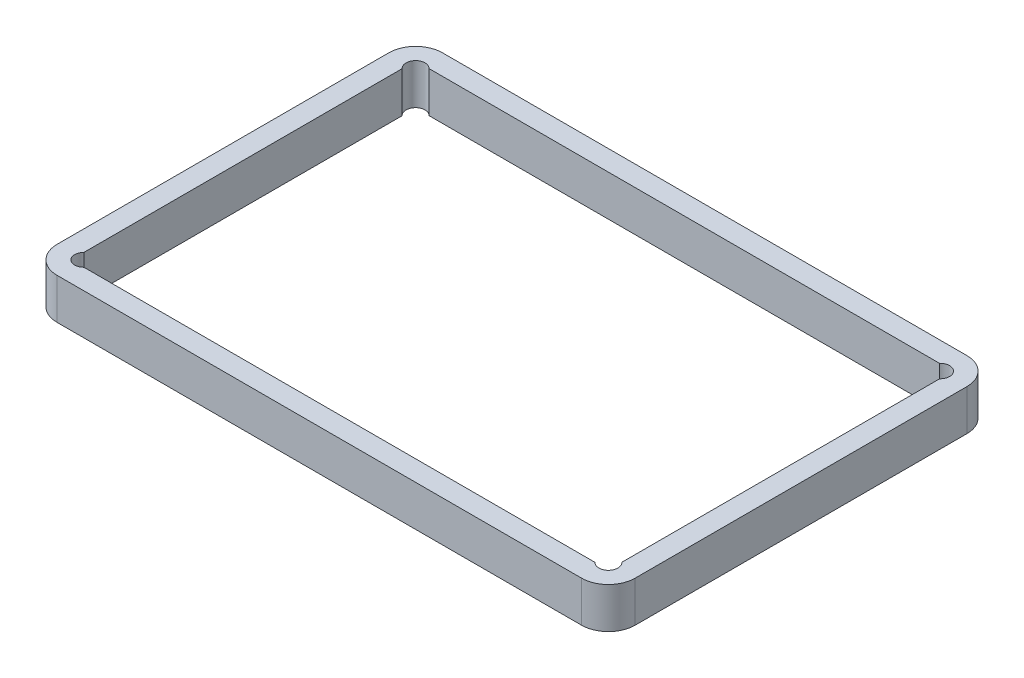
from build123d import *

# Parameters (mm, degrees)
BOSS_EXTRUDE3_DEPTH = 6.35
SKETCH5_R           = 1.4224
SKETCH5_R_2         = 1.4732
CUT_EXTRUDE2_DEPTH  = 55.454774814


with BuildPart() as part:
    # Sketch2 → Boss-Extrude3 (new body)
    with BuildSketch(Plane(origin=(0, 0, 0), x_dir=(1, 0, 0), z_dir=(0, 1, 0))):
        with BuildLine():
            Line((-45, 25.825), (-45, -25.825))
            ThreePointArc((-45, -25.825), (-43.777170811, -28.777170811), (-40.825, -30))
            Line((-40.825, -30), (40.825, -30))
            ThreePointArc((40.825, -30), (43.777170811, -28.777170811), (45, -25.825))
            Line((45, -25.825), (45, 25.825))
            ThreePointArc((45, 25.825), (43.777170811, 28.777170811), (40.825, 30))
            Line((40.825, 30), (-40.825, 30))
            ThreePointArc((-40.825, 30), (-43.777170811, 28.777170811), (-45, 25.825))
        make_face()
        with BuildLine():
            Line((-41.825, -25.825), (-41.825, 25.825))
            ThreePointArc((-41.825, 25.825), (-41.532106781, 26.532106781), (-40.825, 26.825))
            Line((-40.825, 26.825), (40.825, 26.825))
            ThreePointArc((40.825, 26.825), (41.532106781, 26.532106781), (41.825, 25.825))
            Line((41.825, 25.825), (41.825, -25.825))
            ThreePointArc((41.825, -25.825), (41.532106781, -26.532106781), (40.825, -26.825))
            Line((40.825, -26.825), (-40.825, -26.825))
            ThreePointArc((-40.825, -26.825), (-41.532106781, -26.532106781), (-41.825, -25.825))
        make_face(mode=Mode.SUBTRACT)
    extrude(amount=BOSS_EXTRUDE3_DEPTH)

    # Sketch5 → Cut-Extrude2 (cut, through all)
    with BuildSketch(Plane.XZ):
        with Locations((-40.825, 25.825)):
            Circle(SKETCH5_R)
        with Locations((40.825, 25.81487963)):
            Circle(SKETCH5_R_2)
        with Locations((40.825, -25.825)):
            Circle(SKETCH5_R_2)
        with Locations((-40.825, -25.81356336)):
            Circle(SKETCH5_R_2)
    extrude(amount=-CUT_EXTRUDE2_DEPTH, mode=Mode.SUBTRACT)


solid = part.part
